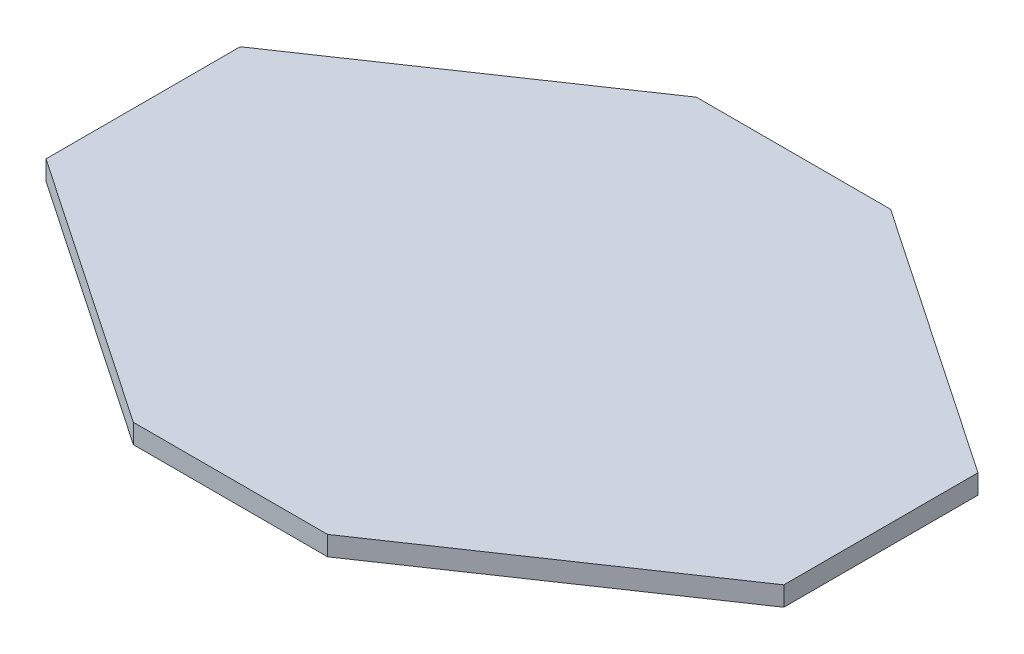
from build123d import *

# Parameters (mm, degrees)
BOSS_EXTRU_1_DEPTH = 10


with BuildPart() as part:
    # Esquisse1 → Boss.-Extru.1 (new body)
    with BuildSketch(Plane(origin=(0, 0, 0), x_dir=(1, 0, 0), z_dir=(0, 1, 0))):
        Polygon((-76.643189126, -51.401333399), (63.356810874, 43.598666601), (163.356810874, 43.598666601), (303.356810874, -51.401333399), (303.356810874, -151.401333399), (163.356810874, -246.401333399), (63.356810874, -246.401333399), (-76.643189126, -151.401333399), align=None)
    extrude(amount=BOSS_EXTRU_1_DEPTH)


solid = part.part
